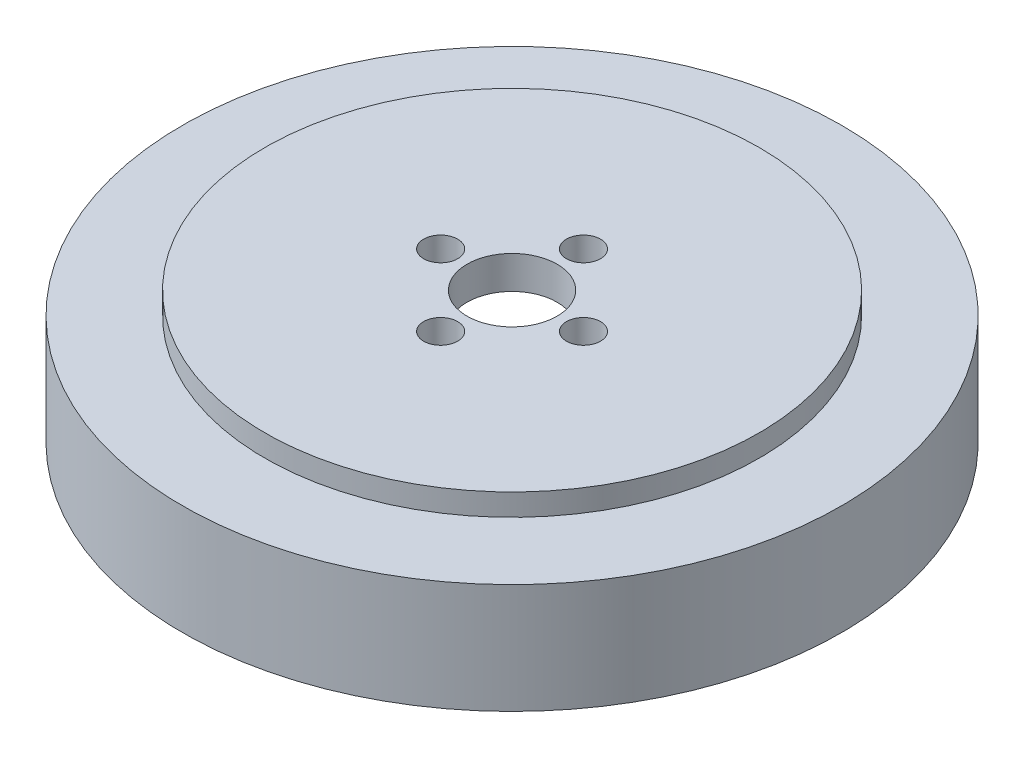
from build123d import *

# Parameters (mm, degrees)
SKETCH_2_W          = 7.5
SKETCH_2_H          = 10
SKETCH_3_R          = 1.55
CUT_EXTRUDE_1_DEPTH = 10


with BuildPart() as part:
    # 草图1 → 旋转1 (revolve)
    with BuildSketch(Plane.XY, mode=Mode.PRIVATE) as revolve_1_sk:
        Polygon((4.1, 0), (4.1, 3), (22.5, 3), (22.5, -10), (21, -10), (21, 0), align=None)
    revolve(revolve_1_sk.sketch.rotate(Axis((0, 0, 0), (0, 1, 0)), 90), axis=Axis((0, 0, 0), (0, 1, 0)))

    # 草图3 → 切除-拉伸1 (cut)
    with BuildSketch(Plane.XZ):
        with Locations(Location((6.5, 0, 0), (0, 0, 270))):
            Circle(SKETCH_3_R)
        with Locations(Location((-6.5, 0, 0), (0, 0, 270))):
            Circle(SKETCH_3_R)
        with Locations(Location((0, 6.5, 0), (0, 0, 270))):
            Circle(SKETCH_3_R)
        with Locations(Location((0, -6.5, 0), (0, 0, 270))):
            Circle(SKETCH_3_R)
    extrude(amount=-CUT_EXTRUDE_1_DEPTH, mode=Mode.SUBTRACT)


with BuildPart() as body_2:
    # 草图2 → 旋转2 (revolve)
    with BuildSketch(Plane.XY, mode=Mode.PRIVATE) as revolve_2_sk:
        with Locations((26.25, -4)):
            Rectangle(SKETCH_2_W, SKETCH_2_H)
    revolve(revolve_2_sk.sketch.rotate(Axis((0, 0, 0), (0, 1, 0)), 90), axis=Axis((0, 0, 0), (0, 1, 0)))


solid = Compound([part.part, body_2.part])
